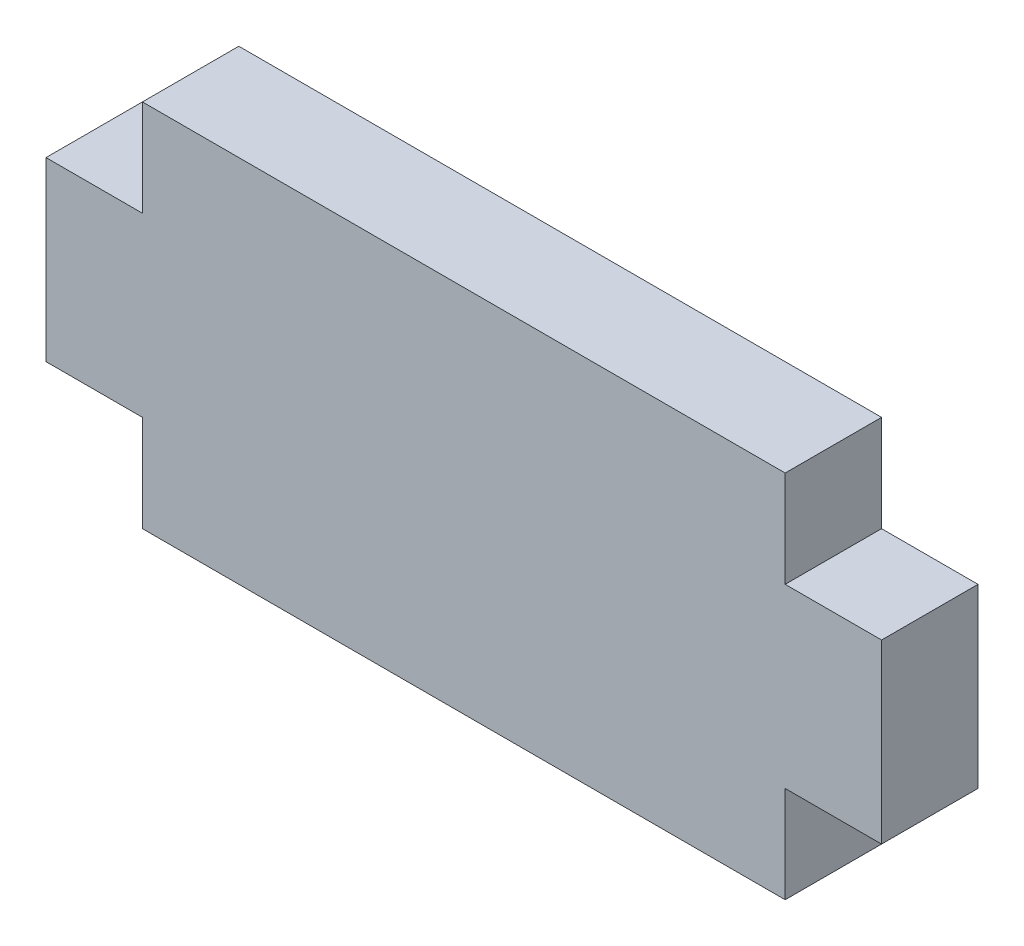
from build123d import *

# Parameters (mm, degrees)
ESQUISSE1_W             = 52
ESQUISSE1_H             = 23
BOSS_EXTRU_1_DEPTH      = 6
ESQUISSE2_W             = 6
ESQUISSE2_H             = 6
ENL_V_MAT_EXTRU_1_DEPTH = 10


with BuildPart() as part:
    # Esquisse1 → Boss.-Extru.1 (new body)
    with BuildSketch(Plane.XY):
        with Locations((26, 11.5)):
            Rectangle(ESQUISSE1_W, ESQUISSE1_H)
    extrude(amount=BOSS_EXTRU_1_DEPTH)

    # Esquisse2 → Enlèv. mat.-Extru.1 (cut)
    with BuildSketch(Plane.XY.offset(6)):
        with Locations((3, 20)):
            Rectangle(ESQUISSE2_W, ESQUISSE2_H)
        with Locations((3, 3)):
            Rectangle(ESQUISSE2_W, ESQUISSE2_H)
        with Locations((49, 3)):
            Rectangle(ESQUISSE2_W, ESQUISSE2_H)
        with Locations((49, 20)):
            Rectangle(ESQUISSE2_W, ESQUISSE2_H)
    extrude(amount=-ENL_V_MAT_EXTRU_1_DEPTH, mode=Mode.SUBTRACT)


solid = part.part
